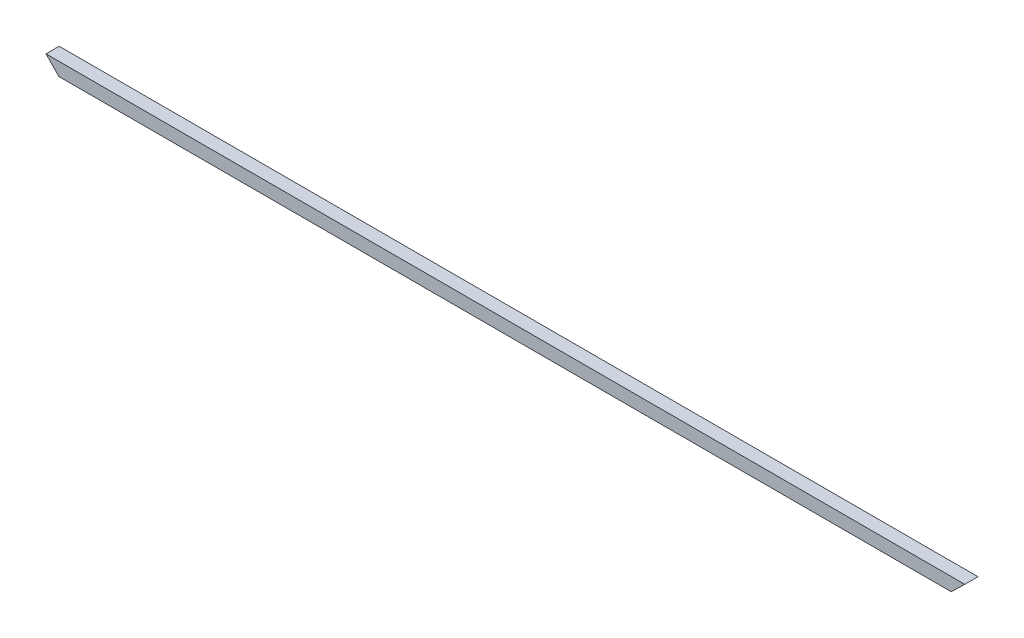
from build123d import *

# Parameters (mm, degrees)
BOSS_EXTRUDE1_DEPTH = 40


with BuildPart() as part:
    # Sketch2 → Boss-Extrude1 (new body)
    with BuildSketch(Plane.XY):
        Polygon((-2761.938929009, 0), (24.361070991, 0), (-16.771831658, -40), (-2723.040628696, -40), align=None)
    extrude(amount=BOSS_EXTRUDE1_DEPTH)


solid = part.part
